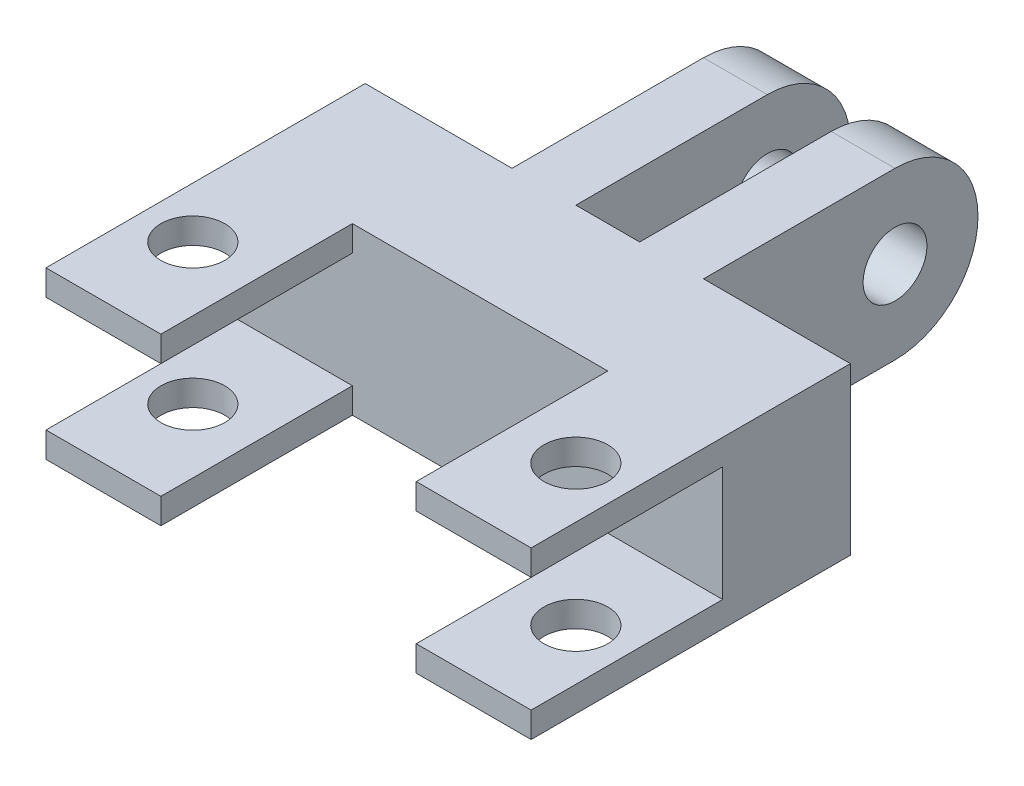
from build123d import *

# Parameters (mm, degrees)
SKETCH_1_W          = 38
SKETCH_1_H          = 13
EXTRUDE_1_DEPTH     = 25
SKETCH_2_W          = 50.27368421
SKETCH_2_H          = 9
CUT_EXTRUDE_1_DEPTH = 15
SKETCH_3_W          = 20
SKETCH_3_H          = 30
CUT_EXTRUDE_2_DEPTH = 34.985290936
SKETCH_4_R          = 2.5
CUT_EXTRUDE_3_DEPTH = 34.985290936
SKETCH_8_R          = 2.5
EXTRUDE_3_DEPTH     = 7.5
SKETCH_9_W          = 5
SKETCH_9_H          = 54.936954578
CUT_EXTRUDE_5_DEPTH = 34.985290936


with BuildPart() as part:
    # 草图1 → 凸台-拉伸1 (new body)
    with BuildSketch(Plane.XY):
        Rectangle(SKETCH_1_W, SKETCH_1_H)
    extrude(amount=EXTRUDE_1_DEPTH)

    # 草图2 → 切除-拉伸1 (cut)
    with BuildSketch(Plane.XY.offset(25)):
        Rectangle(SKETCH_2_W, SKETCH_2_H)
    extrude(amount=-CUT_EXTRUDE_1_DEPTH, mode=Mode.SUBTRACT)

    # 草图3 → 切除-拉伸2 (cut, through all)
    with BuildSketch(Plane(origin=(0, 6.5, 0), x_dir=(1, 0, 0), z_dir=(0, 1, 0))):
        with Locations((0, -25)):
            Rectangle(SKETCH_3_W, SKETCH_3_H)
    extrude(amount=-CUT_EXTRUDE_2_DEPTH, mode=Mode.SUBTRACT)

    # 草图4 → 切除-拉伸3 (cut, through all)
    with BuildSketch(Plane(origin=(0, 6.5, 0), x_dir=(1, 0, 0), z_dir=(0, 1, 0))):
        with Locations(Location((-15, -17.5, 0), (0, 0, 270))):
            Circle(SKETCH_4_R)
        with Locations((15, -17.5)):
            Circle(SKETCH_4_R)
    extrude(amount=-CUT_EXTRUDE_3_DEPTH, mode=Mode.SUBTRACT)

    # 草图8 → 凸台-拉伸3 (add, symmetric)
    with BuildSketch(Plane(origin=(0, 0, 0), x_dir=(0, 0, -1), z_dir=(1, 0, 0))):
        with BuildLine():
            Line((15, -6.5), (0, -6.5))
            Line((0, -6.5), (0, 6.5))
            Line((0, 6.5), (15, 6.5))
            ThreePointArc((15, 6.5), (21.5, 0), (15, -6.5))
        make_face()
        with Locations((15, 0)):
            Circle(SKETCH_8_R, mode=Mode.SUBTRACT)
    extrude(amount=EXTRUDE_3_DEPTH, both=True)

    # 草图9 → 切除-拉伸5 (cut, through all)
    with BuildSketch(Plane(origin=(0, 6.5, 0), x_dir=(1, 0, 0), z_dir=(0, 1, 0))):
        with Locations((0, 27.468477289)):
            Rectangle(SKETCH_9_W, SKETCH_9_H)
    extrude(amount=-CUT_EXTRUDE_5_DEPTH, mode=Mode.SUBTRACT)


solid = part.part
